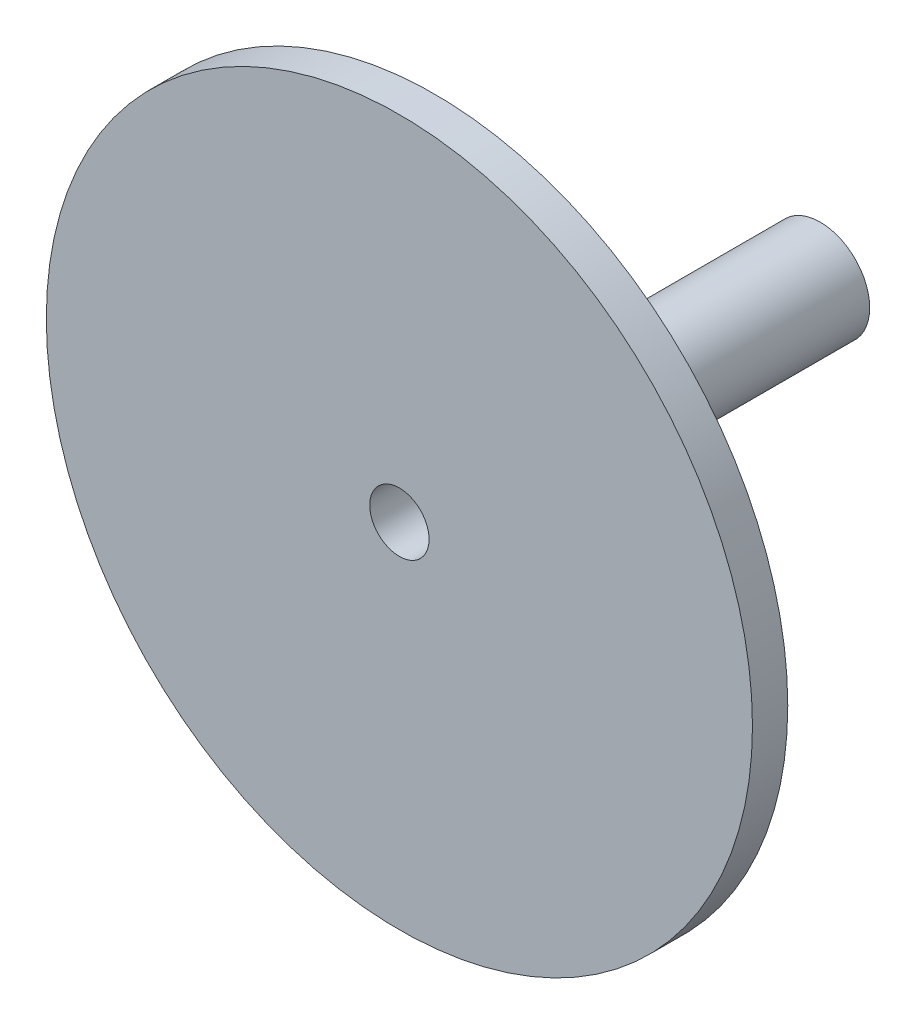
from build123d import *

# Parameters (mm, degrees)
SKETCH1_R           = 4.445
SKETCH1_R_2         = 2.667
BOSS_EXTRUDE1_DEPTH = 37.846
BOSS_EXTRUDE2_START = -3.175
SKETCH2_R           = 31.75
SKETCH2_R_2         = 2.667
BOSS_EXTRUDE2_DEPTH = 3.175


with BuildPart() as part:
    # Sketch1 → Boss-Extrude1 (new body)
    with BuildSketch(Plane.XY):
        Circle(SKETCH1_R)
        Circle(SKETCH1_R_2, mode=Mode.SUBTRACT)
    extrude(amount=BOSS_EXTRUDE1_DEPTH)

    # Sketch2 → Boss-Extrude2 (add)
    with BuildSketch(Plane.XY.offset(37.846).offset(BOSS_EXTRUDE2_START)):
        Circle(SKETCH2_R)
        Circle(SKETCH2_R_2, mode=Mode.SUBTRACT)
    extrude(amount=BOSS_EXTRUDE2_DEPTH)


solid = part.part
